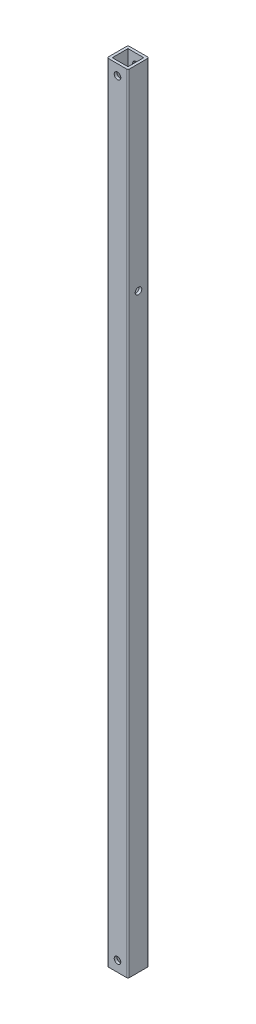
from build123d import *

# Parameters (mm, degrees)
SKETCH1_W           = 16
SKETCH1_H           = 16
SKETCH1_W_2         = 12
SKETCH1_H_2         = 12
BOSS_EXTRUDE1_DEPTH = 600
FILLET1_R           = 1
SKETCH2_R           = 2.5
CUT_EXTRUDE1_DEPTH  = 16
SKETCH3_R           = 2.5
CUT_EXTRUDE2_DEPTH  = 16


with BuildPart() as part:
    # Sketch1 → Boss-Extrude1 (new body)
    with BuildSketch(Plane(origin=(0, 0, 0), x_dir=(1, 0, 0), z_dir=(0, 1, 0))):
        with Locations((3.278287462, -2.788990826)):
            Rectangle(SKETCH1_W, SKETCH1_H)
        with Locations((3.278287462, -2.788990826)):
            Rectangle(SKETCH1_W_2, SKETCH1_H_2, mode=Mode.SUBTRACT)
    extrude(amount=BOSS_EXTRUDE1_DEPTH)

    # Fillet1
    fillet1_edges = [part.edges().sort_by_distance(p)[0] for p in [
        (-4.721712538, 300, -5.211009174),
        (11.278287462, 300, -5.211009174),
        (11.278287462, 300, 10.788990826),
        (-4.721712538, 300, 10.788990826),
    ]]
    fillet(fillet1_edges, radius=FILLET1_R)

    # Sketch2 → Cut-Extrude1 (cut)
    with BuildSketch(Plane.XY.offset(10.788990826)):
        with Locations((3.278287462, 592)):
            Circle(SKETCH2_R)
        with Locations((3.278287462, 8)):
            Circle(SKETCH2_R)
    extrude(amount=-CUT_EXTRUDE1_DEPTH, mode=Mode.SUBTRACT)

    # Sketch3 → Cut-Extrude2 (cut)
    with BuildSketch(Plane(origin=(11.278287462, 0, 0), x_dir=(0, 0, -1), z_dir=(1, 0, 0))):
        with Locations((-2.788990826, 450)):
            Circle(SKETCH3_R)
    extrude(amount=-CUT_EXTRUDE2_DEPTH, mode=Mode.SUBTRACT)


solid = part.part
